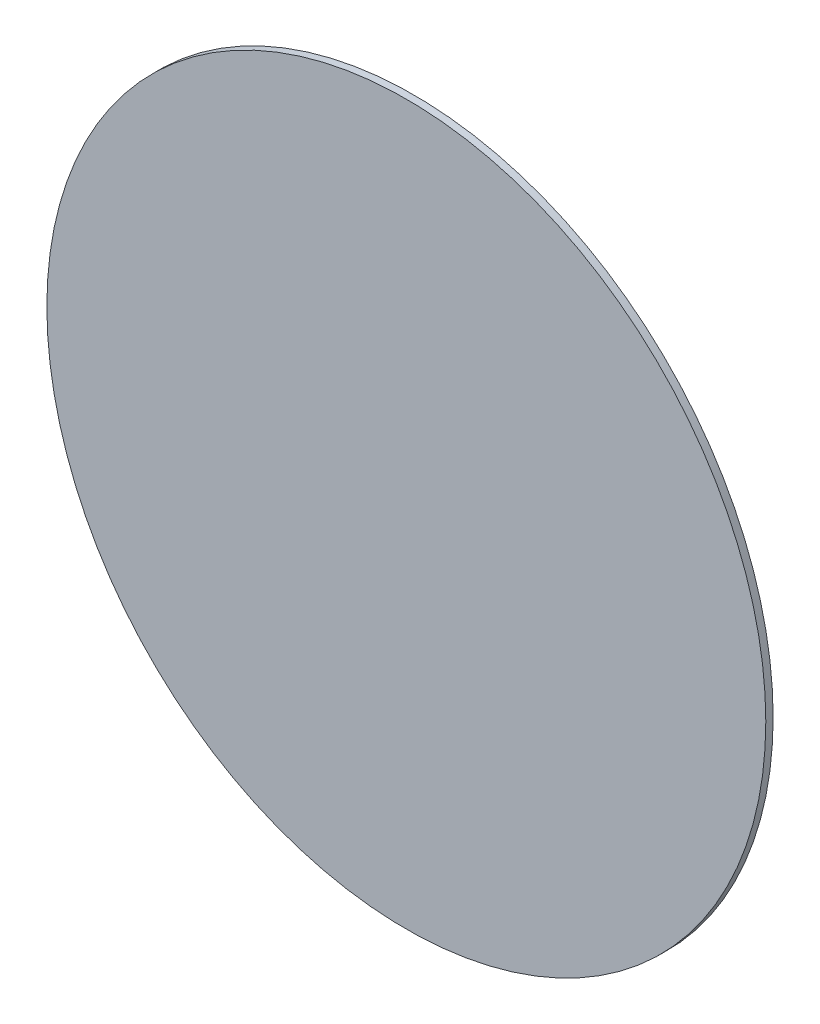
from build123d import *

# Parameters (mm, degrees)
SKETCH1_R           = 147
BOSS_EXTRUDE1_DEPTH = 3


with BuildPart() as part:
    # Sketch1 → Boss-Extrude1 (new body)
    with BuildSketch(Plane.XY):
        Circle(SKETCH1_R)
    extrude(amount=BOSS_EXTRUDE1_DEPTH)


solid = part.part
